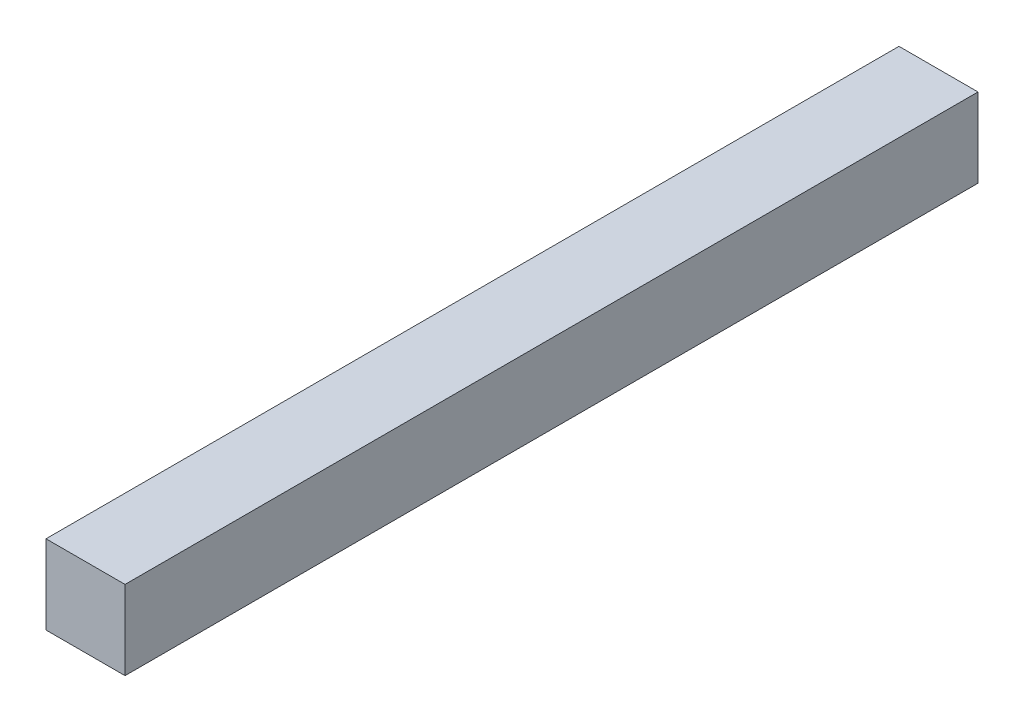
from build123d import *

# Parameters (mm, degrees)
SKETCH1_W           = 2.78
SKETCH1_H           = 2.78
BOSS_EXTRUDE1_DEPTH = 15


with BuildPart() as part:
    # Sketch1 → Boss-Extrude1 (new, symmetric)
    with BuildSketch(Plane.XY):
        Rectangle(SKETCH1_W, SKETCH1_H)
    extrude(amount=BOSS_EXTRUDE1_DEPTH, both=True)


solid = part.part
